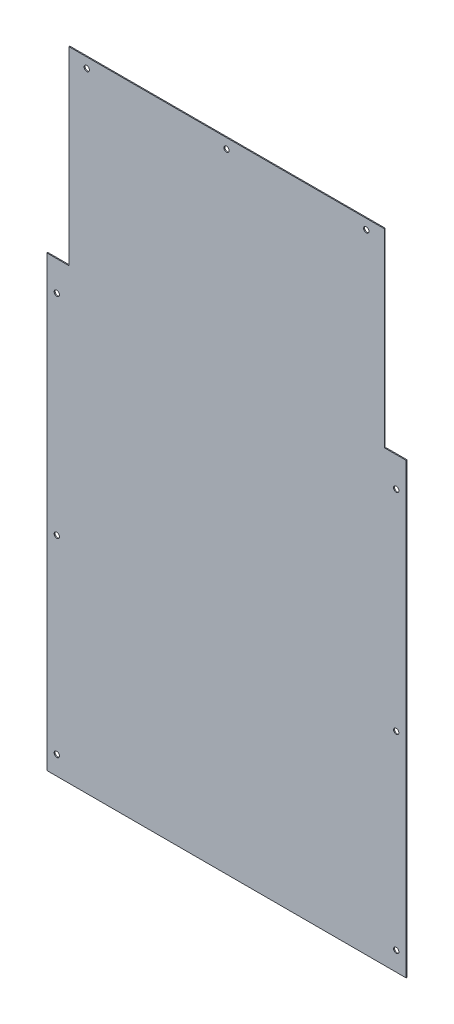
from build123d import *

# Parameters (mm, degrees)
SKETCH1_W               = 457.2
SKETCH1_H               = 840.74
BOSS_EXTRUDE1_DEPTH     = 1.2192
SKETCH5_W               = 27.94
SKETCH5_H               = 241.3
CUT_EXTRUDE1_DEPTH      = 1.2192
F_1_4_CLEARANCE_HOLE2_D = 6.7564


with BuildPart() as part:
    # Sketch1 → Boss-Extrude1 (new body)
    with BuildSketch(Plane.XY):
        with Locations((228.6, 420.37)):
            Rectangle(SKETCH1_W, SKETCH1_H)
    extrude(amount=BOSS_EXTRUDE1_DEPTH)

    # Sketch5 → Cut-Extrude1 (cut)
    with BuildSketch(Plane.XY.offset(1.2192)):
        with Locations((13.97, 690.88)):
            Rectangle(SKETCH5_W, SKETCH5_H)
        Polygon((457.2, 840.74), (0, 840.74), (0, 811.53), (27.94, 811.53), (429.26, 811.53), (457.2, 811.53), align=None)
        with Locations((443.23, 690.88)):
            Rectangle(SKETCH5_W, SKETCH5_H)
    extrude(amount=-CUT_EXTRUDE1_DEPTH, mode=Mode.SUBTRACT)

    # 1/4 Clearance Hole2 (through all)
    with Locations(Plane.XY.offset(1.2192)):
        with Locations((50.8, 798.83), (228.6, 798.83), (406.4, 798.83), (12.7, 532.13), (12.7, 265.43), (12.7, 24.13), (444.5, 24.13), (444.5, 265.43), (444.5, 532.13)):
            Hole(F_1_4_CLEARANCE_HOLE2_D / 2)


solid = part.part
